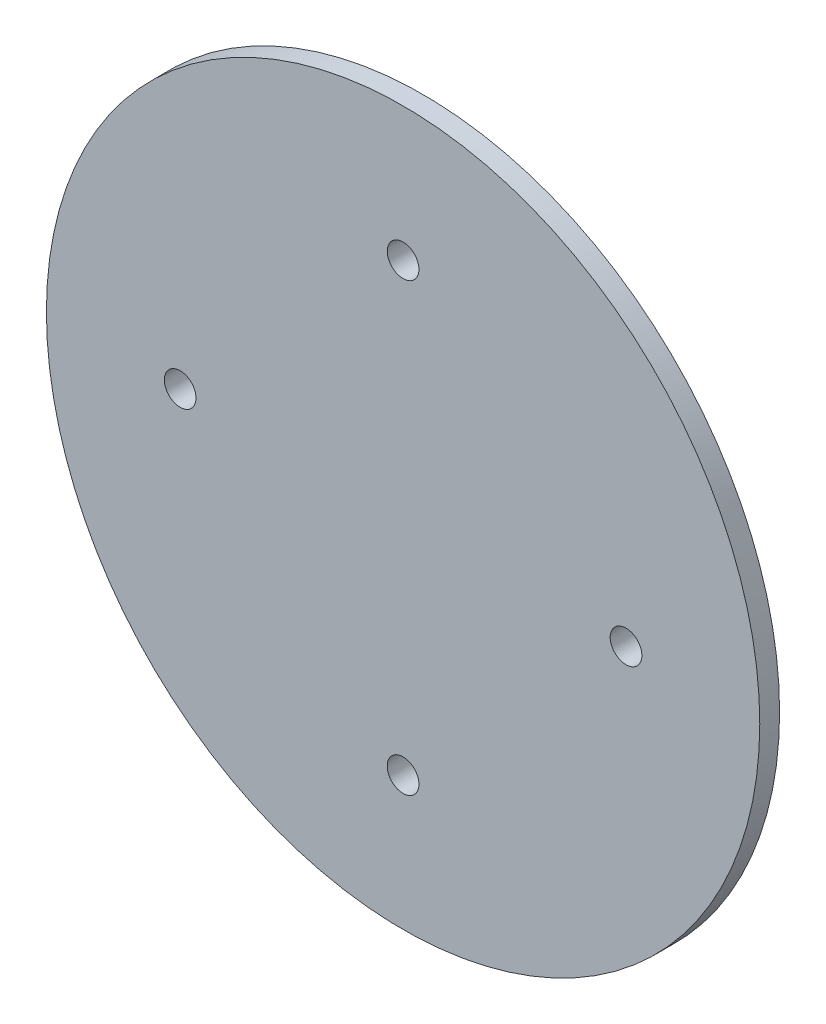
from build123d import *

# Parameters (mm, degrees)
SKETCH_1_R          = 27.5
EXTRUDE_1_DEPTH     = 4
SKETCH_2_R          = 25.4
EXTRUDE_2_DEPTH     = 3.175
SKETCH_3_R          = 1.6
CUT_EXTRUDE_1_DEPTH = 40.547194907
SKETCH_4_R          = 36
SKETCH_4_R_2        = 1.6
EXTRUDE_3_DEPTH     = 2


with BuildPart() as part:
    # ｽｹｯﾁ1 → ﾎﾞｽ - 押し出し1 (new body)
    with BuildSketch(Plane.XY):
        Circle(SKETCH_1_R)
    extrude(amount=EXTRUDE_1_DEPTH)

    # ｽｹｯﾁ2 → ﾎﾞｽ - 押し出し2 (add)
    with BuildSketch(Plane(origin=(0, 0, 0), x_dir=(-1, 0, 0), z_dir=(0, 0, -1))):
        Circle(SKETCH_2_R)
    extrude(amount=EXTRUDE_2_DEPTH)

    # ｽｹｯﾁ3 → ｶｯﾄ - 押し出し1 (cut, through all)
    with BuildSketch(Plane(origin=(0, 0, -3.175), x_dir=(-1, 0, 0), z_dir=(0, 0, -1))):
        with Locations((0, 22.5)):
            Circle(SKETCH_3_R)
        with Locations((22.5, 0)):
            Circle(SKETCH_3_R)
        with Locations((0, -22.5)):
            Circle(SKETCH_3_R)
        with Locations((-22.5, 0)):
            Circle(SKETCH_3_R)
    extrude(amount=-CUT_EXTRUDE_1_DEPTH, mode=Mode.SUBTRACT)

    # ｽｹｯﾁ4 → ﾎﾞｽ - 押し出し3 (add)
    with BuildSketch(Plane.XY.offset(4)):
        Circle(SKETCH_4_R)
        with Locations(Location((0, 22.5, 0), (0, 0, 180))):
            Circle(SKETCH_4_R_2, mode=Mode.SUBTRACT)
        with Locations(Location((-22.5, 0, 0), (0, 0, 180))):
            Circle(SKETCH_4_R_2, mode=Mode.SUBTRACT)
        with Locations(Location((0, -22.5, 0), (0, 0, 180))):
            Circle(SKETCH_4_R_2, mode=Mode.SUBTRACT)
        with Locations(Location((22.5, 0, 0), (0, 0, 180))):
            Circle(SKETCH_4_R_2, mode=Mode.SUBTRACT)
    extrude(amount=EXTRUDE_3_DEPTH)


solid = part.part
